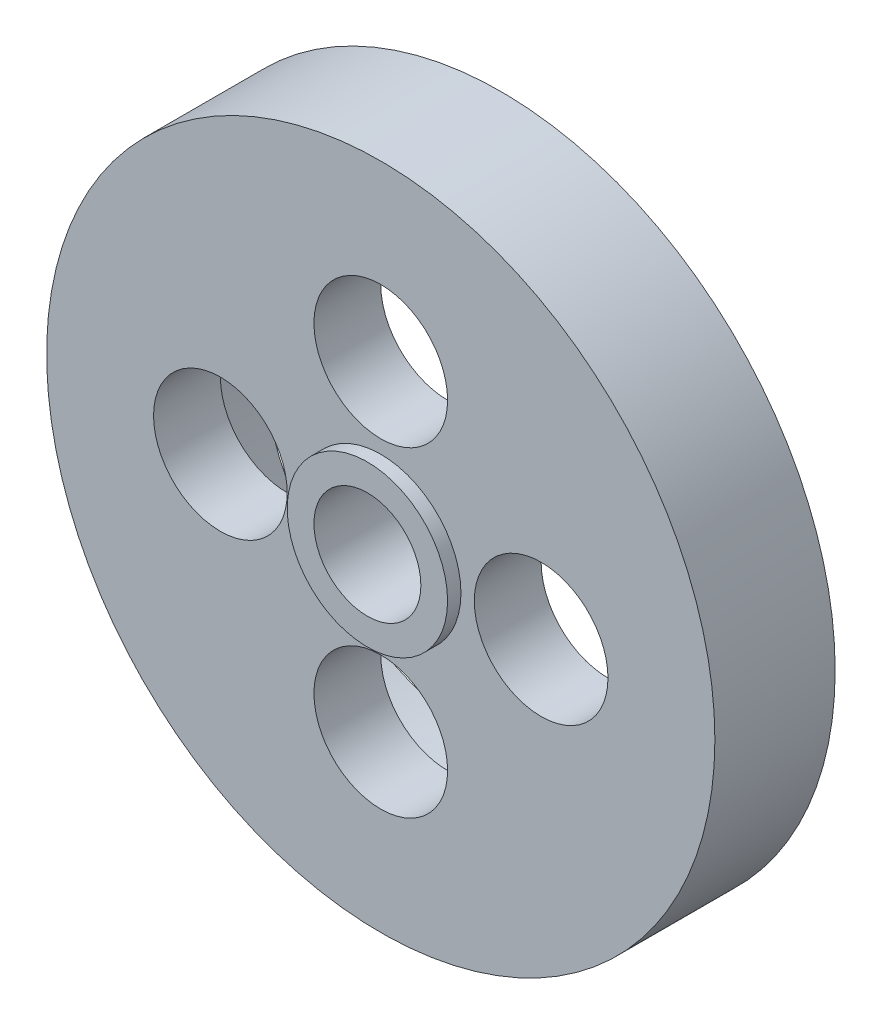
from build123d import *

# Parameters (mm, degrees)
SKETCH1_R           = 25
BOSS_EXTRUDE2_DEPTH = 9
CUT_EXTRUDE9_REACH  = 38.483
SKETCH11_R          = 5
SKETCH12_R          = 4
CUT_EXTRUDE11_DEPTH = 9
SKETCH14_R          = 18
CUT_EXTRUDE12_DEPTH = 4
SKETCH15_R          = 6
SKETCH15_R_2        = 4
BOSS_EXTRUDE4_DEPTH = 1


with BuildPart() as part:
    # Sketch1 → Boss-Extrude2 (new body)
    with BuildSketch(Plane.XY):
        Circle(SKETCH1_R)
    extrude(amount=BOSS_EXTRUDE2_DEPTH)

    # Sketch11 → Cut-Extrude9 (cut, up to next)
    with BuildSketch(Plane(origin=(0, 0, 0), x_dir=(-1, 0, 0), z_dir=(0, 0, -1)), mode=Mode.PRIVATE) as cut_extrude9_sk1:
        with Locations((0, 12)):
            Circle(SKETCH11_R)
    cut_extrude9_tool1 = extrude(cut_extrude9_sk1.sketch, amount=-CUT_EXTRUDE9_REACH, mode=Mode.PRIVATE) & part.part
    # Sketch11 → Cut-Extrude9 (cut, up to next)
    with BuildSketch(Plane(origin=(0, 0, 0), x_dir=(-1, 0, 0), z_dir=(0, 0, -1)), mode=Mode.PRIVATE) as cut_extrude9_sk2:
        with Locations((12, 0)):
            Circle(SKETCH11_R)
    cut_extrude9_tool2 = extrude(cut_extrude9_sk2.sketch, amount=-CUT_EXTRUDE9_REACH, mode=Mode.PRIVATE) & part.part
    # Sketch11 → Cut-Extrude9 (cut, up to next)
    with BuildSketch(Plane(origin=(0, 0, 0), x_dir=(-1, 0, 0), z_dir=(0, 0, -1)), mode=Mode.PRIVATE) as cut_extrude9_sk3:
        with Locations((0, -12)):
            Circle(SKETCH11_R)
    cut_extrude9_tool3 = extrude(cut_extrude9_sk3.sketch, amount=-CUT_EXTRUDE9_REACH, mode=Mode.PRIVATE) & part.part
    # Sketch11 → Cut-Extrude9 (cut, up to next)
    with BuildSketch(Plane(origin=(0, 0, 0), x_dir=(-1, 0, 0), z_dir=(0, 0, -1)), mode=Mode.PRIVATE) as cut_extrude9_sk4:
        with Locations((-12, 0)):
            Circle(SKETCH11_R)
    cut_extrude9_tool4 = extrude(cut_extrude9_sk4.sketch, amount=-CUT_EXTRUDE9_REACH, mode=Mode.PRIVATE) & part.part
    add(cut_extrude9_tool1.solids().sort_by_distance((0, 12, 0))[0], mode=Mode.SUBTRACT)
    add(cut_extrude9_tool2.solids().sort_by_distance((-12, 0, 0))[0], mode=Mode.SUBTRACT)
    add(cut_extrude9_tool3.solids().sort_by_distance((0, -12, 0))[0], mode=Mode.SUBTRACT)
    add(cut_extrude9_tool4.solids().sort_by_distance((12, 0, 0))[0], mode=Mode.SUBTRACT)

    # Sketch12 → Cut-Extrude11 (cut)
    with BuildSketch(Plane(origin=(0, 0, 0), x_dir=(-1, 0, 0), z_dir=(0, 0, -1))):
        Circle(SKETCH12_R)
    extrude(amount=-CUT_EXTRUDE11_DEPTH, mode=Mode.SUBTRACT)

    # Sketch14 → Cut-Extrude12 (cut)
    with BuildSketch(Plane(origin=(0, 0, 0), x_dir=(-1, 0, 0), z_dir=(0, 0, -1))):
        Circle(SKETCH14_R)
    extrude(amount=-CUT_EXTRUDE12_DEPTH, mode=Mode.SUBTRACT)

    # Sketch15 → Boss-Extrude4 (add)
    with BuildSketch(Plane.XY.offset(9)):
        Circle(SKETCH15_R)
        with Locations(Location((0, 0, 0), (0, 0, 180))):
            Circle(SKETCH15_R_2, mode=Mode.SUBTRACT)
    extrude(amount=BOSS_EXTRUDE4_DEPTH)


solid = part.part
